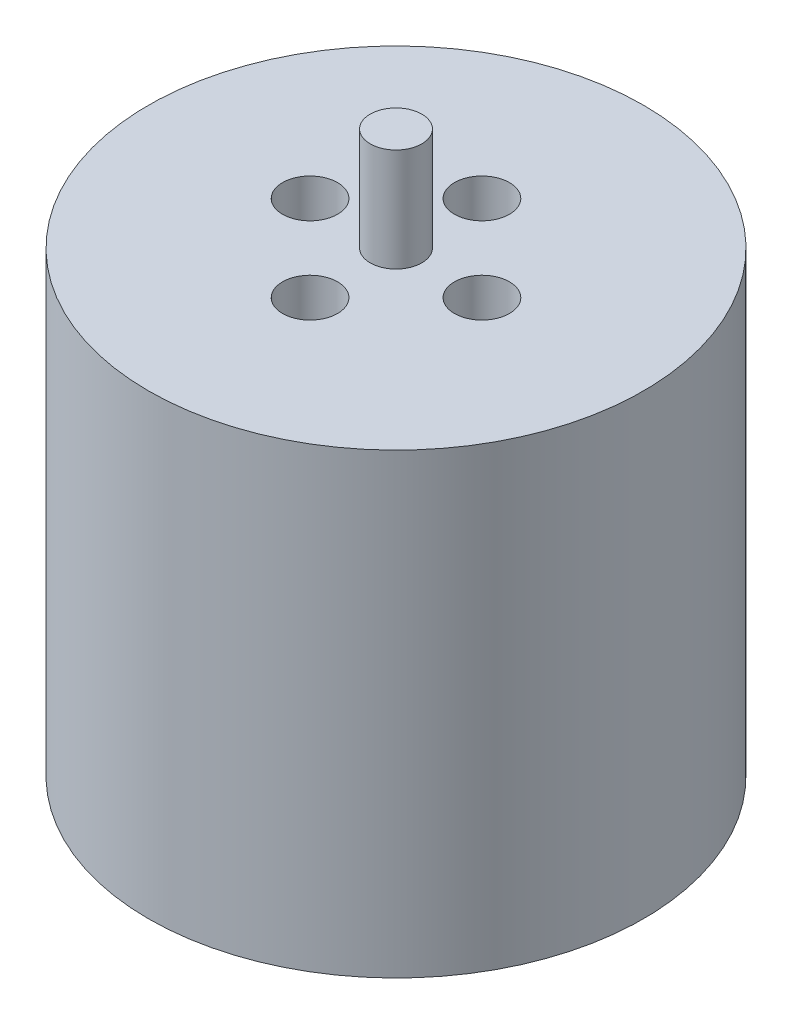
from build123d import *

# Parameters (mm, degrees)
SKETCH1_R           = 7.2
BOSS_EXTRUDE1_DEPTH = 6.65
SKETCH2_R           = 0.75
BOSS_EXTRUDE2_DEPTH = 1
BOSS_EXTRUDE3_START = 3
SKETCH3_R           = 0.75
BOSS_EXTRUDE3_DEPTH = 3
SKETCH4_R           = 0.8
CUT_EXTRUDE1_DEPTH  = 2
SKETCH5_R           = 0.8
CUT_EXTRUDE2_DEPTH  = 2


with BuildPart() as part:
    # Sketch1 → Boss-Extrude1 (new, symmetric)
    with BuildSketch(Plane(origin=(0, 0, 0), x_dir=(1, 0, 0), z_dir=(0, 1, 0))):
        with Locations(Location((0, 0, 0), (0, 0, 270))):
            Circle(SKETCH1_R)
    extrude(amount=BOSS_EXTRUDE1_DEPTH, both=True)

    # Sketch2 → Boss-Extrude2 (add)
    with BuildSketch(Plane.XZ.offset(6.65)):
        with Locations(Location((0, 0, 0), (0, 0, 90))):
            Circle(SKETCH2_R)
    extrude(amount=BOSS_EXTRUDE2_DEPTH)

    # Sketch3 → Boss-Extrude3 (add)
    with BuildSketch(Plane(origin=(0, 6.65, 0), x_dir=(1, 0, 0), z_dir=(0, 1, 0)).offset(BOSS_EXTRUDE3_START)):
        with Locations(Location((0, 0, 0), (0, 0, 270))):
            Circle(SKETCH3_R)
    extrude(amount=-BOSS_EXTRUDE3_DEPTH)

    # Sketch4 → Cut-Extrude1 (cut)
    with BuildSketch(Plane.XZ.offset(6.65)):
        with Locations(Location((0, 4.5, 0), (0, 0, 270))):
            Circle(SKETCH4_R)
        with Locations(Location((4.5, 0, 0), (0, 0, 270))):
            Circle(SKETCH4_R)
        with Locations(Location((0, -4.5, 0), (0, 0, 270))):
            Circle(SKETCH4_R)
        with Locations(Location((-4.5, 0, 0), (0, 0, 270))):
            Circle(SKETCH4_R)
    extrude(amount=-CUT_EXTRUDE1_DEPTH, mode=Mode.SUBTRACT)

    # Sketch5 → Cut-Extrude2 (cut)
    with BuildSketch(Plane(origin=(0, 6.65, 0), x_dir=(1, 0, 0), z_dir=(0, 1, 0))):
        with Locations(Location((2.5, 0, 0), (0, 0, 270))):
            Circle(SKETCH5_R)
        with Locations(Location((0, -2.5, 0), (0, 0, 270))):
            Circle(SKETCH5_R)
        with Locations(Location((-2.5, 0, 0), (0, 0, 270))):
            Circle(SKETCH5_R)
        with Locations(Location((0, 2.5, 0), (0, 0, 270))):
            Circle(SKETCH5_R)
    extrude(amount=-CUT_EXTRUDE2_DEPTH, mode=Mode.SUBTRACT)


solid = part.part
